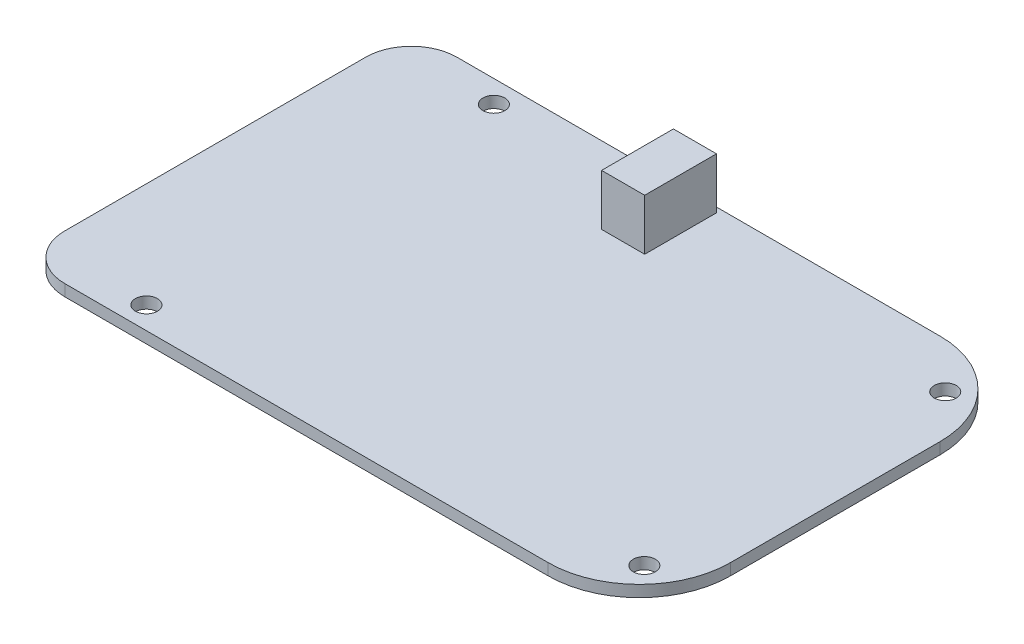
from build123d import *

# Parameters (mm, degrees)
BOSS_EXTRUDE1_DEPTH = 1.6
SKETCH3_R           = 1.53
CUT_EXTRUDE1_DEPTH  = 1.6
SKETCH4_W           = 6
SKETCH4_H           = 10
BOSS_EXTRUDE2_DEPTH = 7.12
SKETCH5_W           = 15.3
SKETCH5_H           = 14
BOSS_EXTRUDE3_DEPTH = 1.7
SKETCH6_W           = 6
SKETCH6_H           = 7
BOSS_EXTRUDE4_DEPTH = 4.6
SKETCH7_W           = 6.3
SKETCH7_H           = 6.75
BOSS_EXTRUDE5_DEPTH = 4.6
SKETCH8_W           = 8.5
SKETCH8_H           = 8.5
BOSS_EXTRUDE6_DEPTH = 4.6


with BuildPart() as part:
    # Sketch1 → Boss-Extrude1 (new body)
    with BuildSketch(Plane(origin=(0, 0, 0), x_dir=(1, 0, 0), z_dir=(0, 1, 0))):
        with BuildLine():
            Line((6.35, 54.61), (73.66, 54.61))
            ThreePointArc((73.66, 54.61), (82.640256121, 50.890256121), (86.36, 41.91))
            Line((86.36, 41.91), (86.36, 12.7))
            ThreePointArc((86.36, 12.7), (82.640256121, 3.719743879), (73.66, 0))
            Line((73.66, 0), (6.35, 0))
            ThreePointArc((6.35, 0), (1.859871939, 1.859871939), (0, 6.35))
            Line((0, 6.35), (0, 48.26))
            ThreePointArc((0, 48.26), (1.859871939, 52.750128061), (6.35, 54.61))
        make_face()
    extrude(amount=BOSS_EXTRUDE1_DEPTH)

    # Sketch3 → Cut-Extrude1 (cut)
    with BuildSketch(Plane(origin=(0, 1.6, 0), x_dir=(1, 0, 0), z_dir=(0, 1, 0))):
        with Locations(Location((80.71, 6.35, 0), (0, 0, 270))):
            Circle(SKETCH3_R)
        with Locations(Location((14.61, 3.11, 0), (0, 0, 270))):
            Circle(SKETCH3_R)
        with Locations(Location((14.61, 51.5, 0), (0, 0, 270))):
            Circle(SKETCH3_R)
        with Locations(Location((80.71, 48.26, 0), (0, 0, 270))):
            Circle(SKETCH3_R)
    extrude(amount=-CUT_EXTRUDE1_DEPTH, mode=Mode.SUBTRACT)

    # Sketch4 → Boss-Extrude2 (add)
    with BuildSketch(Plane(origin=(0, 1.6, 0), x_dir=(1, 0, 0), z_dir=(0, 1, 0))):
        with Locations((40.2, 48.91)):
            Rectangle(SKETCH4_W, SKETCH4_H)
    extrude(amount=BOSS_EXTRUDE2_DEPTH)

    # Sketch5 → Boss-Extrude3 (add)
    with BuildSketch(Plane.XZ):
        with Locations((7.65, -25)):
            Rectangle(SKETCH5_W, SKETCH5_H)
    extrude(amount=BOSS_EXTRUDE3_DEPTH)

    # Sketch6 → Boss-Extrude4 (add)
    with BuildSketch(Plane(origin=(0, 0, 0), x_dir=(-1, 0, 0), z_dir=(0, -1, 0))):
        with Locations((-22.3, 47.11)):
            Rectangle(SKETCH6_W, SKETCH6_H)
    extrude(amount=BOSS_EXTRUDE4_DEPTH)

    # Sketch7 → Boss-Extrude5 (add)
    with BuildSketch(Plane.XZ):
        with Locations((47.15, -49.385)):
            Rectangle(SKETCH7_W, SKETCH7_H)
    extrude(amount=BOSS_EXTRUDE5_DEPTH)

    # Sketch8 → Boss-Extrude6 (add)
    with BuildSketch(Plane.XZ):
        with Locations((61.61, -48.66)):
            Rectangle(SKETCH8_W, SKETCH8_H)
    extrude(amount=BOSS_EXTRUDE6_DEPTH)


solid = part.part
